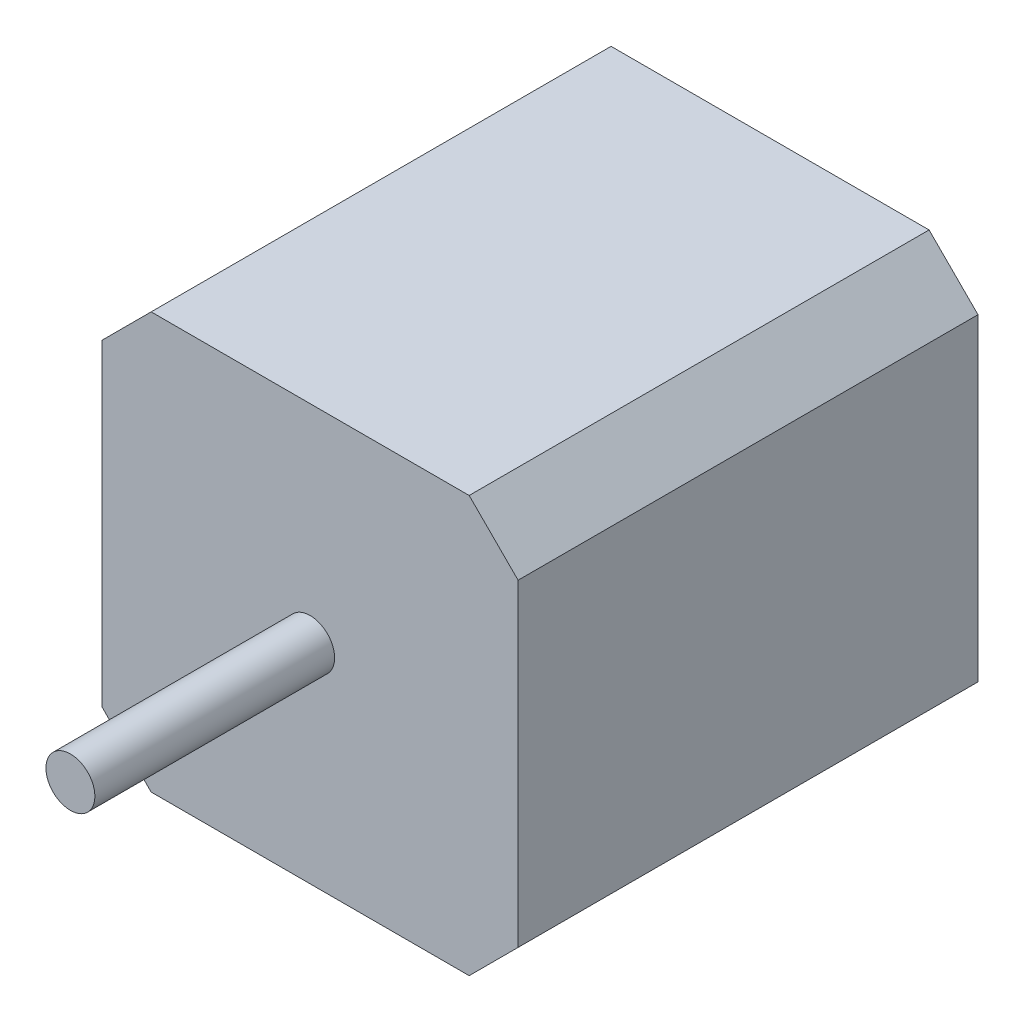
from build123d import *

# Parameters (mm, degrees)
SKETCH1_W           = 42.5
SKETCH1_H           = 42.5
BOSS_EXTRUDE1_DEPTH = 47
CHAMFER1_SIZE       = 5
SKETCH2_R           = 2.5
BOSS_EXTRUDE2_DEPTH = 24.5


with BuildPart() as part:
    # Sketch1 → Boss-Extrude1 (new body)
    with BuildSketch(Plane.XY):
        with Locations((-20.394847779, 6.347974521)):
            Rectangle(SKETCH1_W, SKETCH1_H)
    extrude(amount=BOSS_EXTRUDE1_DEPTH)

    # Chamfer1
    chamfer1_edges = [part.edges().sort_by_distance(p)[0] for p in [
        (-41.644847779, 27.597974521, 23.5),
        (0.855152221, 27.597974521, 23.5),
        (0.855152221, -14.902025479, 23.5),
        (-41.644847779, -14.902025479, 23.5),
    ]]
    chamfer(chamfer1_edges, length=CHAMFER1_SIZE)

    # Sketch2 → Boss-Extrude2 (add)
    with BuildSketch(Plane.XY.offset(47)):
        with Locations((-20.394847779, 6.347974521)):
            Circle(SKETCH2_R)
    extrude(amount=BOSS_EXTRUDE2_DEPTH)


solid = part.part
